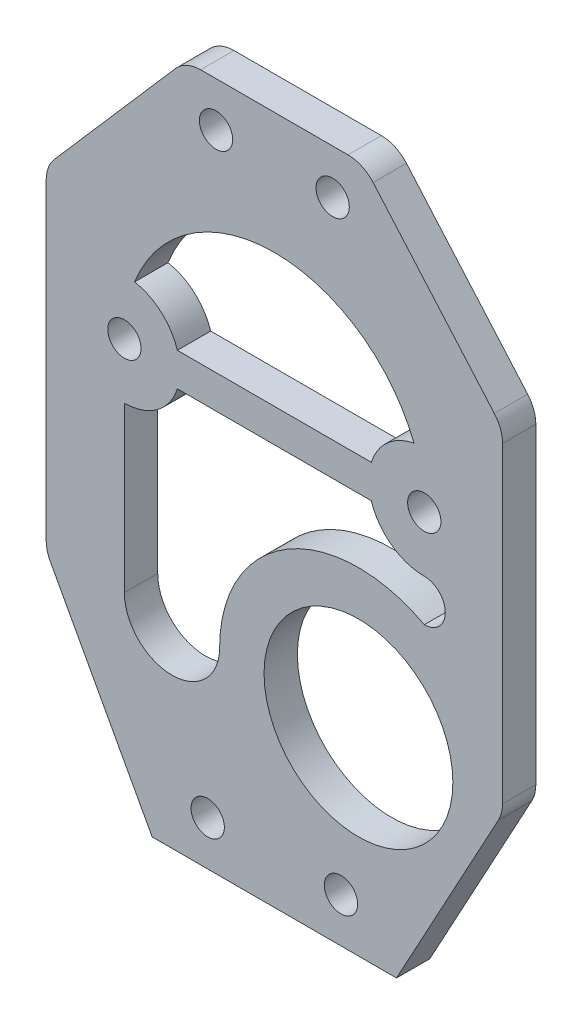
from build123d import *

# Parameters (mm, degrees)
IZIM3_R                     = 1.5
IZIM3_R_2                   = 8.5
Y_KSEKLIK_EKSTR_ZYON1_DEPTH = 3
RADYUS1_R                   = 3


with BuildPart() as part:
    # Çizim3 → Yükseklik-Ekstrüzyon1 (new body)
    with BuildSketch(Plane.XY):
        Polygon((-11, 0), (11, 0), (20.543175205, 17.576342253), (20.543175205, 47.576342253), (8, 62), (-8, 62), (-20.543175205, 47.576342253), (-20.543175205, 17.576342253), align=None)
        with Locations((-6, 4)):
            Circle(IZIM3_R, mode=Mode.SUBTRACT)
        with Locations((6, 4)):
            Circle(IZIM3_R, mode=Mode.SUBTRACT)
        with Locations((-5.25, 57.99)):
            Circle(IZIM3_R, mode=Mode.SUBTRACT)
        with Locations((5.25, 57.99)):
            Circle(IZIM3_R, mode=Mode.SUBTRACT)
        with Locations((-13.5, 37.576342253)):
            Circle(IZIM3_R, mode=Mode.SUBTRACT)
        with Locations((13.5, 37.576342253)):
            Circle(IZIM3_R, mode=Mode.SUBTRACT)
        with Locations((7.573825848, 17.79076532)):
            Circle(IZIM3_R_2, mode=Mode.SUBTRACT)
        with BuildLine():
            Line((-8.730303993, 36.076342253), (8.730303993, 36.076342253))
            ThreePointArc((8.730303993, 36.076342253), (10.541960108, 33.545213379), (13.5, 32.576342253))
            ThreePointArc((13.5, 32.576342253), (15.389824267, 30.686517986), (13.5, 28.796693719))
            ThreePointArc((13.5, 28.796693719), (1.163957554, 28.522195255), (-4.926174152, 17.79076532))
            ThreePointArc((-4.926174152, 17.79076532), (-9.213087076, 13.503852396), (-13.5, 17.79076532))
            Line((-13.5, 17.79076532), (-13.5, 32.576342253))
            ThreePointArc((-13.5, 32.576342253), (-10.541960108, 33.545213379), (-8.730303993, 36.076342253))
        make_face(mode=Mode.SUBTRACT)
        with BuildLine():
            Line((-8.730303993, 39.076342253), (8.730303993, 39.076342253))
            ThreePointArc((8.730303993, 39.076342253), (10.179901517, 41.314917658), (12.574074074, 42.489860461))
            ThreePointArc((12.574074074, 42.489860461), (0, 51.076342253), (-12.574074074, 42.489860461))
            ThreePointArc((-12.574074074, 42.489860461), (-10.179901517, 41.314917658), (-8.730303993, 39.076342253))
        make_face(mode=Mode.SUBTRACT)
    extrude(amount=Y_KSEKLIK_EKSTR_ZYON1_DEPTH)

    # Radyus1
    radyus1_edges = [part.edges().sort_by_distance(p)[0] for p in [
        (-8, 62, 1.5),
        (8, 62, 1.5),
        (20.543175205, 47.576342253, 1.5),
        (20.543175205, 17.576342253, 1.5),
        (-20.543175205, 17.576342253, 1.5),
        (-20.543175205, 47.576342253, 1.5),
    ]]
    fillet(radyus1_edges, radius=RADYUS1_R)


solid = part.part
